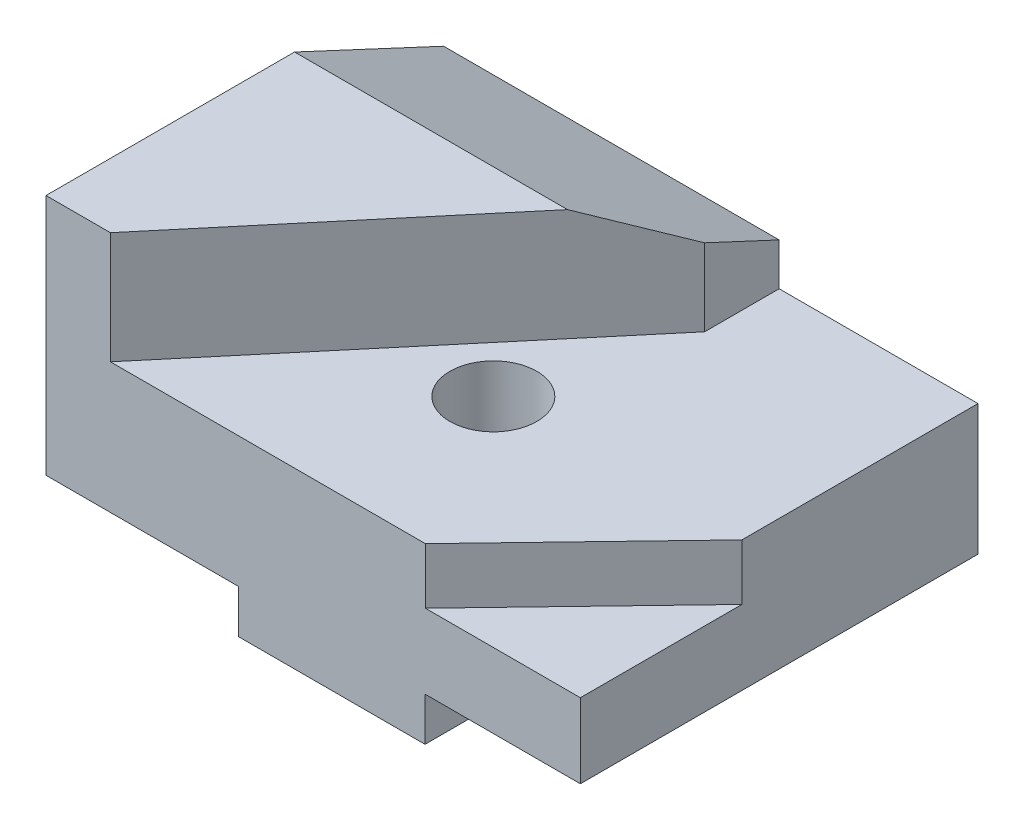
from build123d import *

# Parameters (mm, degrees)
BOSS_EXTRUDE1_DEPTH = 64
CUT_EXTRUDE1_DEPTH  = 93.374238833
SKETCH4_R           = 7
CUT_EXTRUDE2_DEPTH  = 18
CUT_EXTRUDE7_REACH  = 118.653
SKETCH4_6_R         = 7
CUT_EXTRUDE8_START  = -18
CUT_EXTRUDE8_DEPTH  = 9


with BuildPart() as part:
    # Sketch1 → Boss-Extrude1 (new body)
    with BuildSketch(Plane.XY):
        Polygon((0, 0), (0, 39), (54, 39), (54, 21), (86, 21), (86, 0), (61, 0), (61, -7), (31, -7), (31, 0), align=None)
    extrude(amount=-BOSS_EXTRUDE1_DEPTH)

    # Sketch3 → Cut-Extrude1 (cut, through all)
    with BuildSketch(Plane(origin=(54, 0, 0), x_dir=(0, 0, -1), z_dir=(1, 0, 0))):
        Polygon((40, 39), (64, 27.808616204), (64, 39), align=None)
    extrude(amount=-CUT_EXTRUDE1_DEPTH, mode=Mode.SUBTRACT)

    # Sketch4 → Cut-Extrude2 (cut)
    # profile 1 of 2: a face of its own
    with BuildSketch(Plane(origin=(0, 39, 0), x_dir=(1, 0, 0), z_dir=(0, 1, 0))):
        Polygon((54, 40), (54, 52), (43.930804426, 40), align=None)
    # profile 2 of 2: a face of its own
    with BuildSketch(Plane(origin=(0, 39, 0), x_dir=(1, 0, 0), z_dir=(0, 1, 0))):
        Polygon((54, 40), (43.930804426, 40), (10.366819179, 0), (54, 0), align=None)
        with Locations((46, 26)):
            Circle(SKETCH4_R, mode=Mode.SUBTRACT)
    extrude(amount=-CUT_EXTRUDE2_DEPTH, mode=Mode.SUBTRACT)

    # Sketch4<6> → Cut-Extrude7 (cut, up to next)
    with BuildSketch(Plane(origin=(0, 39, 0), x_dir=(1, 0, 0), z_dir=(0, 1, 0)), mode=Mode.PRIVATE) as cut_extrude7_sk1:
        with Locations((46, 26)):
            Circle(SKETCH4_6_R)
    cut_extrude7_tool1 = extrude(cut_extrude7_sk1.sketch, amount=-CUT_EXTRUDE7_REACH, mode=Mode.PRIVATE) & part.part
    add(cut_extrude7_tool1.solids().sort_by_distance((46, 39, -26))[0], mode=Mode.SUBTRACT)

    # Sketch4<7> → Cut-Extrude8 (cut)
    with BuildSketch(Plane(origin=(0, 39, 0), x_dir=(1, 0, 0), z_dir=(0, 1, 0)).offset(CUT_EXTRUDE8_START)):
        Polygon((86, -0.057865332), (86, 26), (61, -0.057865332), align=None)
    extrude(amount=-CUT_EXTRUDE8_DEPTH, mode=Mode.SUBTRACT)


solid = part.part
